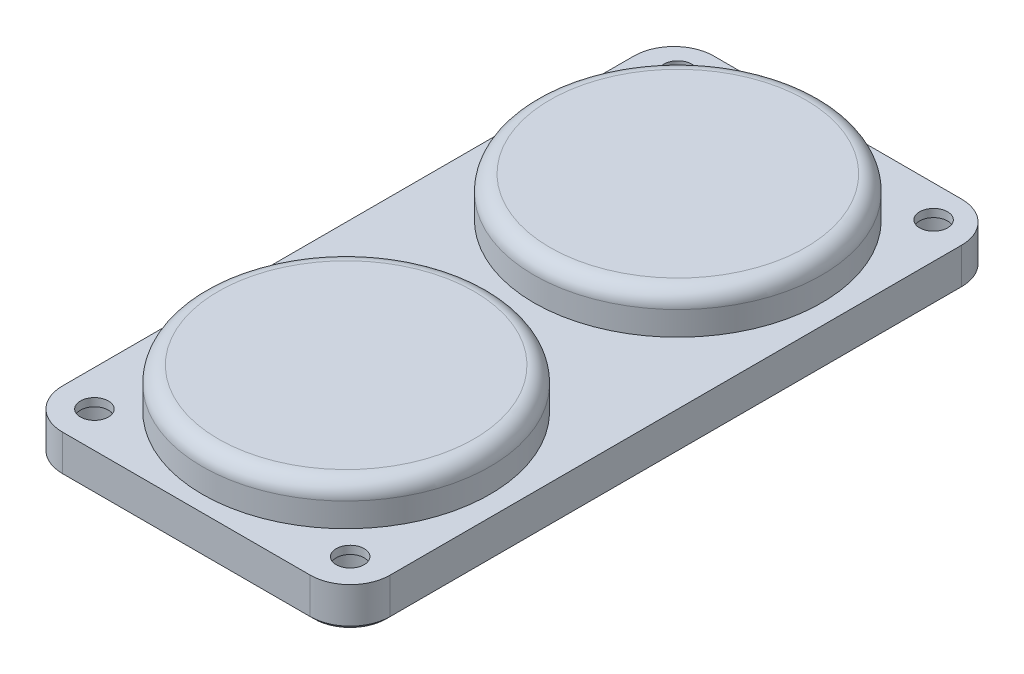
from build123d import *

# Parameters (mm, degrees)
BOSS_EXTRUDE1_DEPTH  = 5
SKETCH2_R            = 1.75
CUT_EXTRUDE1_DEPTH   = 66.019227925
SKETCH5_R            = 18
BOSS_EXTRUDE2_DEPTH  = 5
FILLET1_R            = 2
FILLET1_OF_MIRROR3_R = 2
SKETCH6_R            = 3.25
CUT_EXTRUDE3_DEPTH   = 4
CHAMFER1_SIZE        = 0.5


with BuildPart() as part:
    # Sketch1 → Boss-Extrude1 (new body)
    with BuildSketch(Plane(origin=(0, 0, 0), x_dir=(1, 0, 0), z_dir=(0, 1, 0))):
        with BuildLine():
            Line((-20.5, 56.5), (-20.5, -15))
            ThreePointArc((-20.5, -15), (-19.035533906, -18.535533906), (-15.5, -20))
            Line((-15.5, -20), (15.5, -20))
            ThreePointArc((15.5, -20), (19.035533906, -18.535533906), (20.5, -15))
            Line((20.5, -15), (20.5, 56.5))
            ThreePointArc((20.5, 56.5), (19.035533906, 60.035533906), (15.5, 61.5))
            Line((15.5, 61.5), (-15.5, 61.5))
            ThreePointArc((-15.5, 61.5), (-19.035533906, 60.035533906), (-20.5, 56.5))
        make_face()
    extrude(amount=-BOSS_EXTRUDE1_DEPTH)

    # Sketch2 → Cut-Extrude1 (cut, symmetric)
    with BuildSketch(Plane.XZ.offset(5)):
        with Locations(Location((-16, -57.5, 0), (0, 0, 270))):
            Circle(SKETCH2_R)
        with Locations(Location((-16, 15.5, 0), (0, 0, 270))):
            Circle(SKETCH2_R)
    cut_extrude1 = extrude(amount=CUT_EXTRUDE1_DEPTH, both=True, mode=Mode.SUBTRACT)

    # Mirror1: Cut-Extrude1 across plane
    add(cut_extrude1.mirror(Plane(origin=(0, 0, 0), x_dir=(0, 0, 1), z_dir=(1, 0, 0))), mode=Mode.SUBTRACT)

    # Sketch5 → Boss-Extrude2 (add)
    with BuildSketch(Plane(origin=(0, 0, 0), x_dir=(1, 0, 0), z_dir=(0, 1, 0))):
        with Locations(Location((0, 41.5, 0), (0, 0, 90))):
            Circle(SKETCH5_R)
    boss_extrude2 = extrude(amount=BOSS_EXTRUDE2_DEPTH)

    # Fillet1
    fillet1_edges = [part.edges().sort_by_distance(p)[0] for p in [
        (0, 5, -23.5),
    ]]
    fillet(fillet1_edges, radius=FILLET1_R)

    # Mirror3: Boss-Extrude2 across plane
    add(boss_extrude2.mirror(Plane(origin=(0, 0, -20.75), x_dir=(1, 0, 0), z_dir=(0, 0, -1))))

    # Fillet1 of Mirror3
    fillet1_of_mirror3_edges = [part.edges().sort_by_distance(p)[0] for p in [
        (0, 5, -18),
    ]]
    fillet(fillet1_of_mirror3_edges, radius=FILLET1_OF_MIRROR3_R)

    # Sketch6 → Cut-Extrude3 (cut)
    with BuildSketch(Plane.XZ.offset(5)):
        with Locations(Location((-16, -57.5, 0), (0, 0, 270))):
            Circle(SKETCH6_R)
        with Locations(Location((16, 15.5, 0), (0, 0, 270))):
            Circle(SKETCH6_R)
        with Locations(Location((-16, 15.5, 0), (0, 0, 270))):
            Circle(SKETCH6_R)
        with Locations(Location((16, -57.5, 0), (0, 0, 270))):
            Circle(SKETCH6_R)
    extrude(amount=-CUT_EXTRUDE3_DEPTH, mode=Mode.SUBTRACT)

    # Chamfer1
    chamfer1_edges = [part.edges().sort_by_distance(p)[0] for p in [
        (-19.035533906, -5, 18.535533906),
        (0, -5, 20),
        (19.035533906, -5, 18.535533906),
        (20.5, -5, -20.75),
        (19.035533906, -5, -60.035533906),
        (0, -5, -61.5),
        (-19.035533906, -5, -60.035533906),
        (-20.5, -5, -20.75),
    ]]
    chamfer(chamfer1_edges, length=CHAMFER1_SIZE)


solid = part.part
